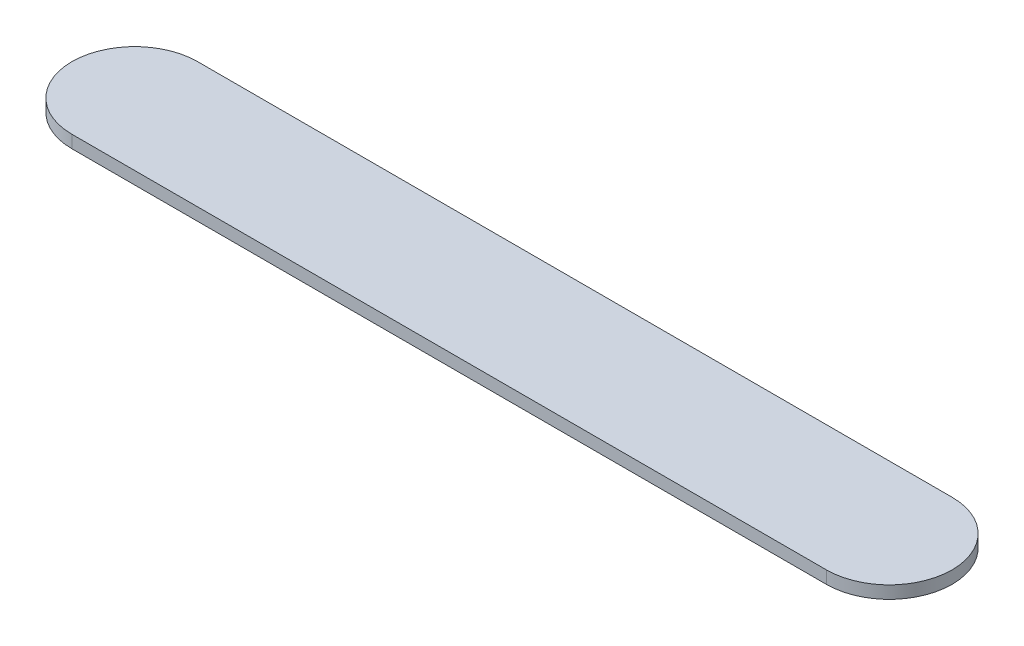
from build123d import *

# Parameters (mm, degrees)
BOSS_EXTRUDE1_DEPTH = 1.5875


with BuildPart() as part:
    # Sketch1 → Boss-Extrude1 (new body)
    with BuildSketch(Plane(origin=(0, 0, 0), x_dir=(1, 0, 0), z_dir=(0, 1, 0))):
        with BuildLine():
            Line((-47.625, 7.9375), (47.625, 7.9375))
            ThreePointArc((47.625, 7.9375), (55.5625, 0), (47.625, -7.9375))
            Line((47.625, -7.9375), (-47.625, -7.9375))
            ThreePointArc((-47.625, -7.9375), (-55.5625, 0), (-47.625, 7.9375))
        make_face()
    extrude(amount=BOSS_EXTRUDE1_DEPTH)


solid = part.part
